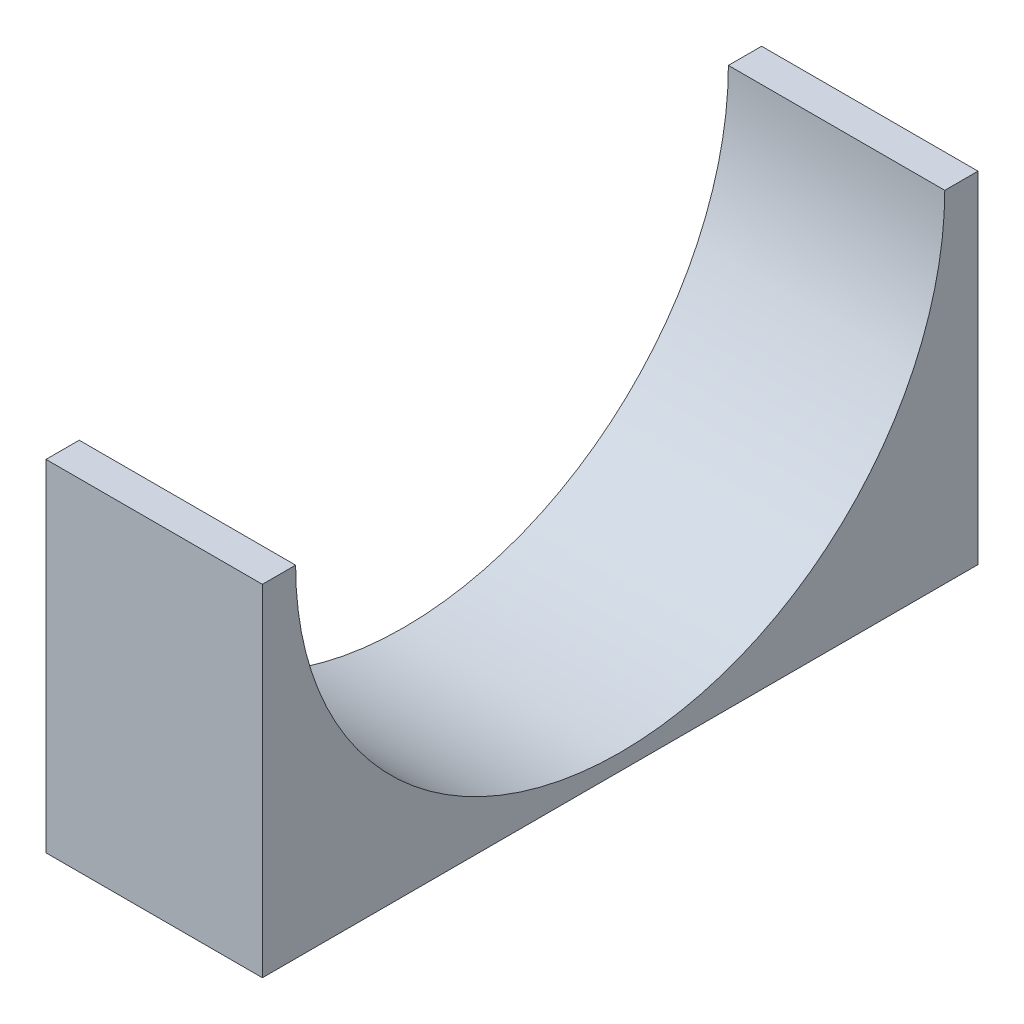
from build123d import *

# Parameters (mm, degrees)
SKETCH1_W               = 25.4
SKETCH1_H               = 84
BOSS_EXTRUDE1_DEPTH     = 40
CUT_EXTRUDE1_DEPTH      = 15
CUT_EXTRUDE1_DEPTH_BACK = 15
SKETCH4_R               = 38.1


with BuildPart() as part:
    # Sketch1 → Boss-Extrude1 (new body)
    with BuildSketch(Plane(origin=(0, 0, 0), x_dir=(1, 0, 0), z_dir=(0, 1, 0))):
        Rectangle(SKETCH1_W, SKETCH1_H)
    extrude(amount=BOSS_EXTRUDE1_DEPTH)

    # Sketch4 → Cut-Extrude1 (cut, two sides: drawn at the far end of the back side and taken through both)
    with BuildSketch(Plane(origin=(0, 0, 0), x_dir=(0, 0, -1), z_dir=(1, 0, 0)).offset(-CUT_EXTRUDE1_DEPTH_BACK)):
        with Locations((0, 40)):
            Circle(SKETCH4_R)
    extrude(amount=CUT_EXTRUDE1_DEPTH + CUT_EXTRUDE1_DEPTH_BACK, mode=Mode.SUBTRACT)


solid = part.part
